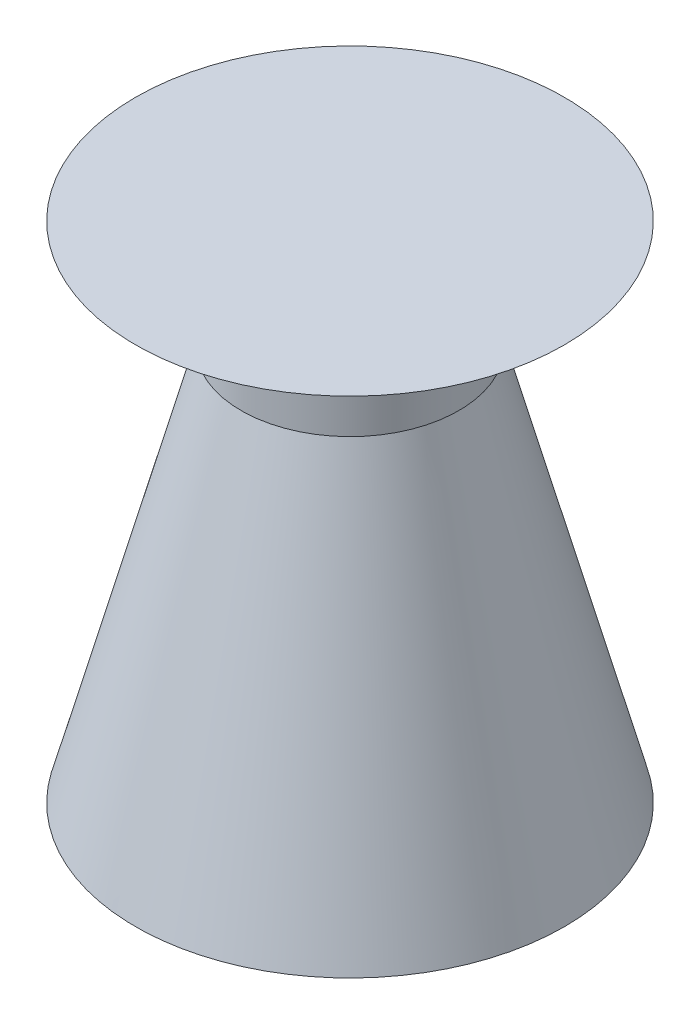
from build123d import *


with BuildPart() as part:
    # Sketch1 → Revolve1 (revolve)
    with BuildSketch(Plane.XY, mode=Mode.PRIVATE) as revolve1_sk:
        Polygon((0, 32.821912554), (0, -32.821912554), (27.94, -32.821912554), (14.18082, 18.528046277), (14.18082, 24.878046277), (27.94, 32.821912554), align=None)
    revolve(revolve1_sk.sketch.rotate(Axis((0, 32.821912554, 0), (0, -1, 0)), 180), axis=Axis((0, 32.821912554, 0), (0, -1, 0)))


solid = part.part
